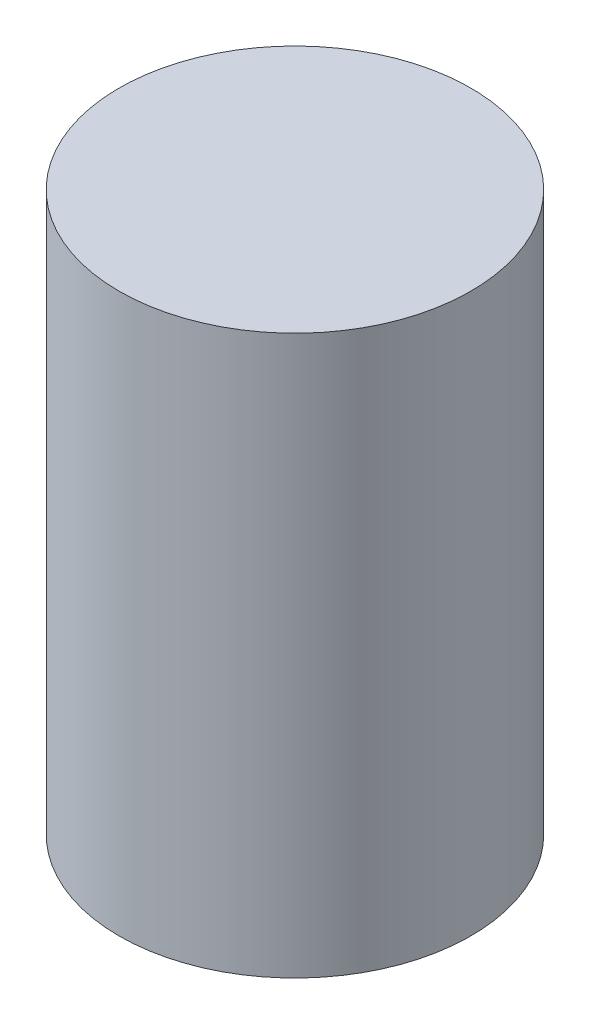
from build123d import *

# Parameters (mm, degrees)
SKETCH2_R           = 16.002
BOSS_EXTRUDE1_DEPTH = 50.8


with BuildPart() as part:
    # Sketch2 → Boss-Extrude1 (new body)
    with BuildSketch(Plane(origin=(0, 0, 0), x_dir=(1, 0, 0), z_dir=(0, 1, 0))):
        with Locations(Location((0, 0, 0), (0, 0, 270))):
            Circle(SKETCH2_R)
    extrude(amount=BOSS_EXTRUDE1_DEPTH)


solid = part.part
